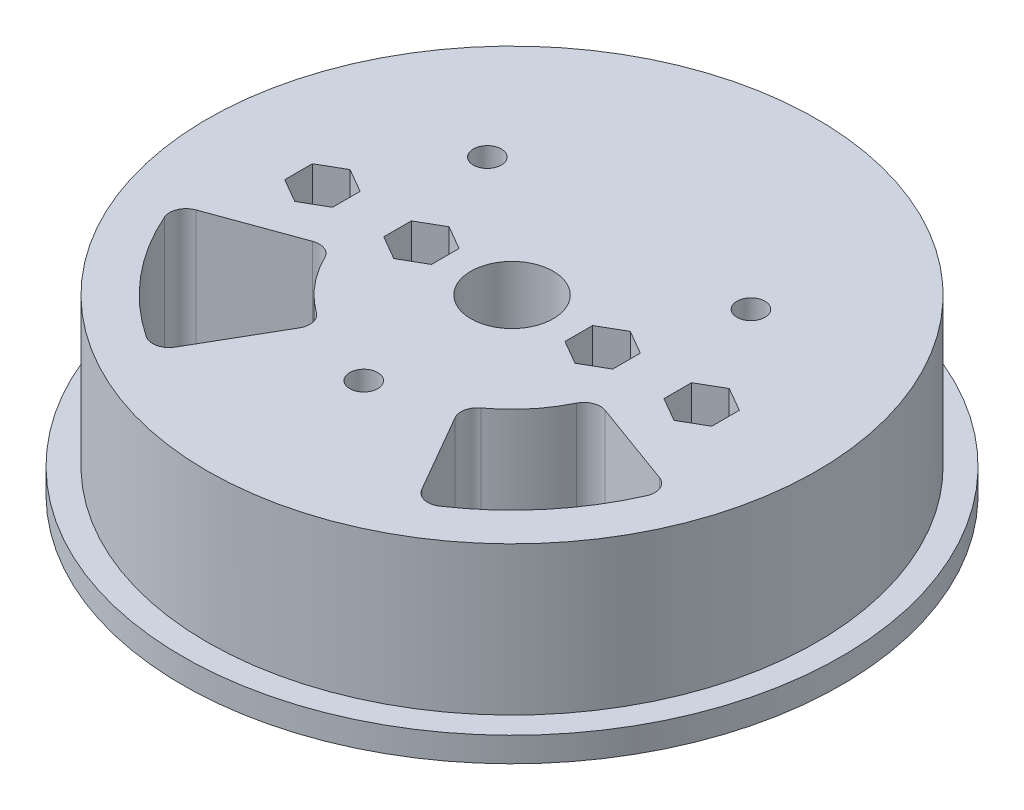
from build123d import *
from build123d.topology import SkipClean

# Parameters (mm, degrees)
CORTAR_EXTRUIR1_DEPTH      = 13
CROQUIS3_R                 = 1.7
CORTAR_EXTRUIR2_DEPTH      = 17
CORTAR_EXTRUIR3_DEPTH      = 1.5
CORTAR_EXTRUIR3_DEPTH_BACK = 1.5
CROQUIS5_R                 = 5
CORTAR_EXTRUIR4_DEPTH      = 21
CROQUIS6_R                 = 8.2
CORTAR_EXTRUIR5_DEPTH      = 9
CROQUIS7_W                 = 30.6
CROQUIS7_H                 = 7
CORTAR_EXTRUIR6_DEPTH      = 4
CROQUIS8_R                 = 1.7
CORTAR_EXTRUIR7_DEPTH      = 17
CORTAR_EXTRUIR8_DEPTH      = 11
CORTAR_EXTRUIR9_DEPTH      = 21
CROQUIS11_R                = 1.7
CORTAR_EXTRUIR10_DEPTH     = 21
CROQUIS12_R                = 2.95
CORTAR_EXTRUIR11_DEPTH     = 3
BOSS_EXTRUDE1_START        = 3
SKETCH1_R                  = 7
BOSS_EXTRUDE1_DEPTH        = 3
SKETCH2_R                  = 1.7
CUT_EXTRUDE1_DEPTH         = 62.449166022
CUT_EXTRUDE2_DEPTH         = 22.5


with BuildPart() as part:
    # Croquis1 → Revolución1 (revolve)
    with BuildSketch(Plane.XY, mode=Mode.PRIVATE) as revoluci_n1_sk:
        Polygon((0, 0), (40, 0), (40, 3), (37, 3), (37, 21), (0, 21), align=None)
    revolve(revoluci_n1_sk.sketch.rotate(Axis((0, 21, 0), (0, -1, 0)), 90), axis=Axis((0, 21, 0), (0, -1, 0)))

    # Croquis2 → Cortar-Extruir1 (cut)
    with BuildSketch(Plane.XZ):
        Polygon((-11.5, -19.5), (11.5, -19.5), (11.5, -23), (5, -29.5), (5, -54.5), (2.5, -54.5), (2.5, -29.5), (9, -23), (-9, -23), (-2.5, -29.5), (-2.5, -54.5), (-5, -54.5), (-5, -29.5), (-11.5, -23), align=None)
    extrude(amount=-CORTAR_EXTRUIR1_DEPTH, mode=Mode.SUBTRACT)

    # Croquis3 → Cortar-Extruir2 (cut)
    with BuildSketch(Plane.XY.offset(-40)):
        with Locations(Location((0, 6.5, 0), (0, 0, 180))):
            Circle(CROQUIS3_R)
    extrude(amount=CORTAR_EXTRUIR2_DEPTH, mode=Mode.SUBTRACT)

    # Croquis4 → Cortar-Extruir3 (cut, two sides: drawn at the far end of the back side and taken through both)
    with BuildSketch(Plane.XY.offset(-25.85).offset(-CORTAR_EXTRUIR3_DEPTH_BACK)):
        Polygon((0, 9.85), (-2.901185103, 8.175), (-2.901185103, 4.825), (-2.901185103, -1.825), (2.901185103, -1.825), (2.901185103, 4.825), (2.901185103, 8.175), align=None)
    extrude(amount=CORTAR_EXTRUIR3_DEPTH + CORTAR_EXTRUIR3_DEPTH_BACK, mode=Mode.SUBTRACT)

    # Croquis5 → Cortar-Extruir4 (cut)
    with BuildSketch(Plane(origin=(0, 21, 0), x_dir=(1, 0, 0), z_dir=(0, 1, 0))):
        with Locations(Location((0, 0, 0), (0, 0, 270))):
            Circle(CROQUIS5_R)
    extrude(amount=-CORTAR_EXTRUIR4_DEPTH, mode=Mode.SUBTRACT)

    # Croquis6 → Cortar-Extruir5 (cut)
    with BuildSketch(Plane.XZ):
        with Locations(Location((0, 0, 0), (0, 0, 270))):
            Circle(CROQUIS6_R)
    extrude(amount=-CORTAR_EXTRUIR5_DEPTH, mode=Mode.SUBTRACT)

    # Croquis7 → Cortar-Extruir6 (cut)
    with BuildSketch(Plane.XZ):
        Rectangle(CROQUIS7_W, CROQUIS7_H)
    extrude(amount=-CORTAR_EXTRUIR6_DEPTH, mode=Mode.SUBTRACT)

    # Croquis8 → Cortar-Extruir7 (cut)
    with BuildSketch(Plane.XZ.offset(-4)):
        with Locations(Location((-11, 0, 0), (0, 0, 270))):
            Circle(CROQUIS8_R)
        with Locations(Location((11, 0, 0), (0, 0, 270))):
            Circle(CROQUIS8_R)
    extrude(amount=-CORTAR_EXTRUIR7_DEPTH, mode=Mode.SUBTRACT)

    # Croquis9 → Cortar-Extruir8 (cut)
    with BuildSketch(Plane(origin=(0, 21, 0), x_dir=(1, 0, 0), z_dir=(0, 1, 0))):
        Polygon((-11, 3.35), (-13.901185103, 1.675), (-13.901185103, -1.675), (-11, -3.35), (-8.098814897, -1.675), (-8.098814897, 1.675), align=None)
        Polygon((11, 3.35), (8.098814897, 1.675), (8.098814897, -1.675), (11, -3.35), (13.901185103, -1.675), (13.901185103, 1.675), align=None)
        Polygon((-25.916185103, 1.675), (-23.015, 3.35), (-20.113814897, 1.675), (-20.113814897, -1.675), (-23.015, -3.35), (-25.916185103, -1.675), align=None)
        Polygon((20.113814897, 1.675), (23.015, 3.35), (25.916185103, 1.675), (25.916185103, -1.675), (23.015, -3.35), (20.113814897, -1.675), align=None)
    extrude(amount=-CORTAR_EXTRUIR8_DEPTH, mode=Mode.SUBTRACT)

    # Croquis10 → Cortar-Extruir9 (cut)
    with BuildSketch(Plane.XZ):
        with BuildLine():
            Line((9.447221814, 16.363068172), (14.966629547, 25.922962794))
            ThreePointArc((14.966629547, 25.922962794), (16.245761141, 26.871003909), (17.811925712, 26.584493647))
            ThreePointArc((17.811925712, 26.584493647), (24.51342218, 20.56920351), (29.273623894, 12.924973661))
            ThreePointArc((29.273623894, 12.924973661), (29.283819798, 11.332850665), (28.128062687, 10.237777566))
            Line((28.128062687, 10.237777566), (17.754969251, 6.462280318))
            ThreePointArc((17.754969251, 6.462280318), (16.322400804, 6.487021228), (15.273989073, 7.4635955))
            ThreePointArc((15.273989073, 7.4635955), (13.022755533, 10.927389365), (10.002507082, 13.745903101))
            ThreePointArc((10.002507082, 13.745903101), (9.222823954, 14.947967445), (9.447221814, 16.363068172))
        make_face()
    cortar_extruir9 = extrude(amount=-CORTAR_EXTRUIR9_DEPTH, mode=Mode.SUBTRACT)

    # Simetría1: Cortar-Extruir9 across plane
    add(cortar_extruir9.mirror(Plane(origin=(0, 0, 0), x_dir=(0, 0, 1), z_dir=(1, 0, 0))), mode=Mode.SUBTRACT)

    # Croquis11 → Cortar-Extruir10 (cut)
    with BuildSketch(Plane.XZ):
        with Locations(Location((-16, -13, 0), (0, 0, 270))):
            Circle(CROQUIS11_R)
        with Locations(Location((16, -13, 0), (0, 0, 270))):
            Circle(CROQUIS11_R)
        with Locations(Location((0, 18, 0), (0, 0, 270))):
            Circle(CROQUIS11_R)
    extrude(amount=-CORTAR_EXTRUIR10_DEPTH, mode=Mode.SUBTRACT)

    # Croquis12 → Cortar-Extruir11 (cut)
    with BuildSketch(Plane.XZ):
        with Locations(Location((-16, -13, 0), (0, 0, 270))):
            Circle(CROQUIS12_R)
        with Locations(Location((16, -13, 0), (0, 0, 270))):
            Circle(CROQUIS12_R)
        with Locations(Location((0, 18, 0), (0, 0, 270))):
            Circle(CROQUIS12_R)
    extrude(amount=-CORTAR_EXTRUIR11_DEPTH, mode=Mode.SUBTRACT)

    # Sketch1 → Boss-Extrude1 (add)
    with SkipClean():  # the faces are left unmerged after this step: merging them gives an invalid solid
        with BuildSketch(Plane.XZ.offset(BOSS_EXTRUDE1_START)):
            with BuildLine():
                Line((-13.206887408, 7.625), (-8.660254038, 5))
                ThreePointArc((-8.660254038, 5), (0, 10), (8.660254038, 5))
                Line((8.660254038, 5), (13.206887408, 7.625))
                ThreePointArc((13.206887408, 7.625), (8.046591752, 12.954337543), (0.982257886, 15.218333333))
                ThreePointArc((0.982257886, 15.218333333), (0, 15.05), (-0.982257886, 15.218333333))
                ThreePointArc((-0.982257886, 15.218333333), (-8.046591752, 12.954337543), (-13.206887408, 7.625))
            make_face()
            with BuildLine():
                Line((13.206887408, -7.625), (8.660254038, -5))
                ThreePointArc((8.660254038, -5), (0, -10), (-8.660254038, -5))
                Line((-8.660254038, -5), (-13.206887408, -7.625))
                ThreePointArc((-13.206887408, -7.625), (0, -15.25), (13.206887408, -7.625))
            make_face()
            with Locations(Location((23.015, 0, 0), (0, 0, 90))):
                Circle(SKETCH1_R)
            with Locations(Location((-23.015, 0, 0), (0, 0, 90))):
                Circle(SKETCH1_R)
        extrude(amount=-BOSS_EXTRUDE1_DEPTH)

    # Sketch2 → Cut-Extrude1 (cut, through all)
    with SkipClean():  # the faces are left unmerged after this step: merging them gives an invalid solid
        with BuildSketch(Plane(origin=(0, -3, 0), x_dir=(-1, 0, 0), z_dir=(0, -1, 0))):
            with Locations(Location((23.015, 0, 0), (0, 0, 90))):
                Circle(SKETCH2_R)
            with Locations(Location((-23.015, 0, 0), (0, 0, 90))):
                Circle(SKETCH2_R)
        extrude(amount=-CUT_EXTRUDE1_DEPTH, mode=Mode.SUBTRACT)

    # Sketch3 → Cut-Extrude2 (cut)
    with SkipClean():  # the faces are left unmerged after this step: merging them gives an invalid solid
        with BuildSketch(Plane(origin=(0, 21, 0), x_dir=(1, 0, 0), z_dir=(0, 1, 0))):
            Polygon((-25.916185103, 1.675), (-23.015, 3.35), (-20.113814897, 1.675), (-20.113814897, -1.675), (-23.015, -3.35), (-25.916185103, -1.675), align=None)
            Polygon((23.015, 3.35), (20.113814897, 1.675), (20.113814897, -1.675), (23.015, -3.35), (25.916185103, -1.675), (25.916185103, 1.675), align=None)
        extrude(amount=-CUT_EXTRUDE2_DEPTH, mode=Mode.SUBTRACT)


solid = part.part
